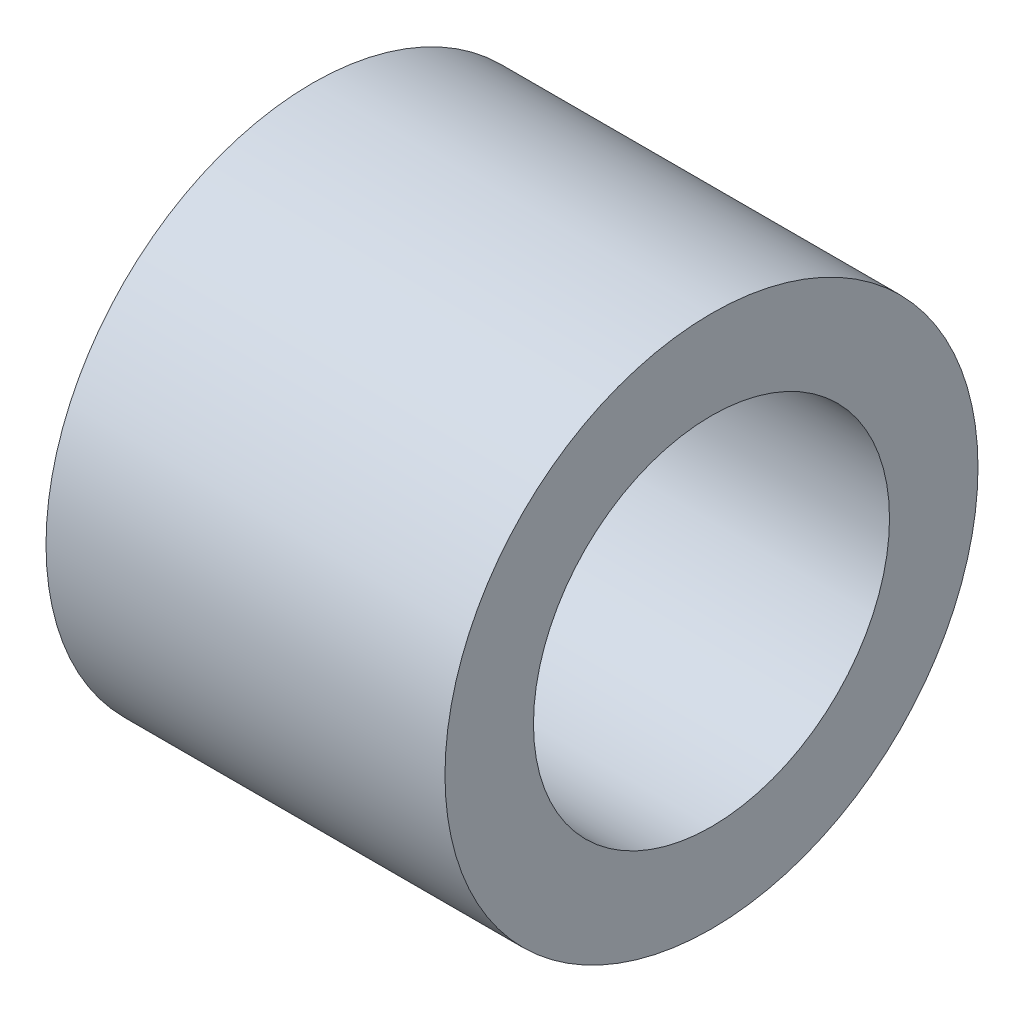
from build123d import *

# Parameters (mm, degrees)
SKETCH1_R           = 3.18135
SKETCH1_R_2         = 2.124999941
BOSS_EXTRUDE1_DEPTH = 2.38125


with BuildPart() as part:
    # Sketch1 → Boss-Extrude1 (new, symmetric)
    with BuildSketch(Plane(origin=(0, 0, 0), x_dir=(0, 0, -1), z_dir=(1, 0, 0))):
        with Locations(Location((0, 0, 0), (0, 0, 180))):
            Circle(SKETCH1_R)
        with Locations(Location((0, 0, 0), (0, 0, 180))):
            Circle(SKETCH1_R_2, mode=Mode.SUBTRACT)
    extrude(amount=BOSS_EXTRUDE1_DEPTH, both=True)


solid = part.part
